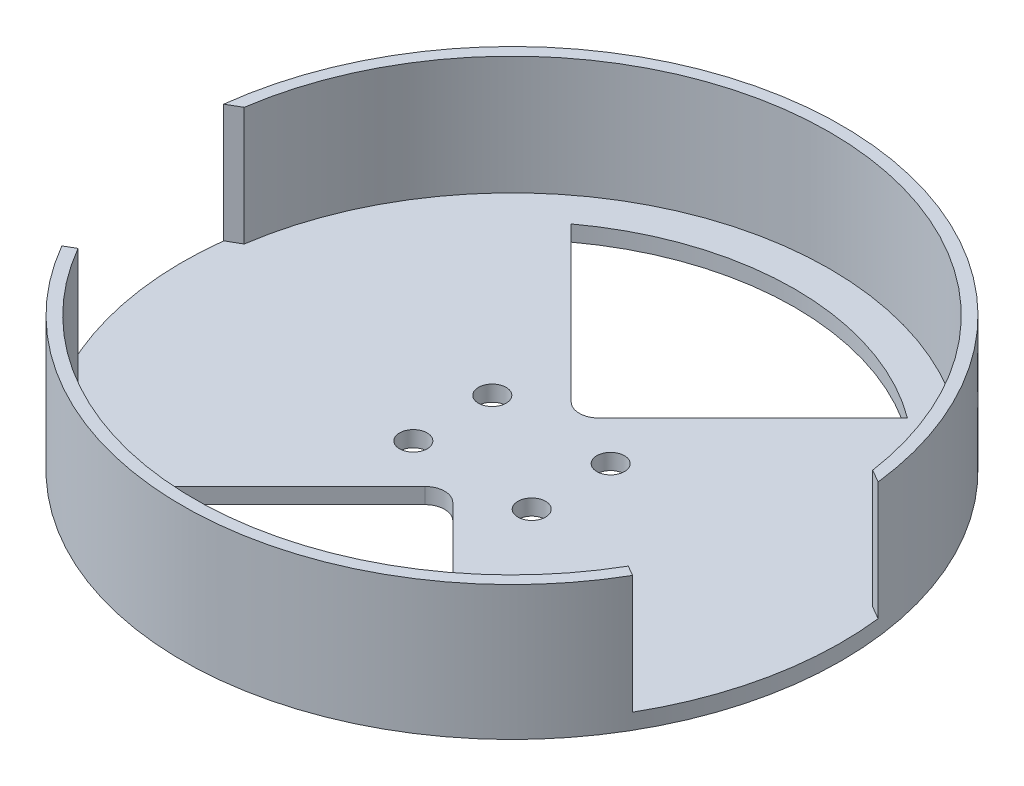
from build123d import *

# Parameters (mm, degrees)
CROQUIS1_R              = 80.5
SALIENTE_EXTRUIR1_DEPTH = 4
CROQUIS2_R              = 83.5
CROQUIS2_R_2            = 80.5
EXTRUIR_L_MINA1_DEPTH   = 34
CORTAR_EXTRUIR1_START   = -30
CORTAR_EXTRUIR1_DEPTH   = 30
CORTAR_EXTRUIR3_DEPTH   = 4
CROQUIS6_R              = 3.5
CORTAR_EXTRUIR4_DEPTH   = 10


with BuildPart() as part:
    # Croquis1 → Saliente-Extruir1 (new body)
    with BuildSketch(Plane(origin=(0, 0, 0), x_dir=(1, 0, 0), z_dir=(0, 1, 0))):
        with Locations(Location((0, 0, 0), (0, 0, 270))):
            Circle(CROQUIS1_R)
    extrude(amount=SALIENTE_EXTRUIR1_DEPTH)

    # Croquis2 → Extruir-Lámina1 (add)
    with BuildSketch(Plane(origin=(0, 0, 0), x_dir=(1, 0, 0), z_dir=(0, 1, 0))):
        Circle(CROQUIS2_R)
        Circle(CROQUIS2_R_2, mode=Mode.SUBTRACT)
    extrude(amount=EXTRUIR_L_MINA1_DEPTH)

    # Croquis3 → Cortar-Extruir1 (cut)
    with BuildSketch(Plane(origin=(0, 34, 0), x_dir=(1, 0, 0), z_dir=(0, 1, 0)).offset(CORTAR_EXTRUIR1_START)):
        with BuildLine():
            Line((82.915347707, 9.8638286), (79.63686942, 11.756658922))
            ThreePointArc((79.63686942, 11.756658922), (80.283927371, 5.894150138), (80.5, 0))
            ThreePointArc((80.5, 0), (77.757029016, -20.834933131), (69.715045005, -40.25))
            Line((69.715045005, -40.25), (72.313121216, -41.75))
            ThreePointArc((72.313121216, -41.75), (80.654806495, -21.611390266), (83.5, 0))
            ThreePointArc((83.5, 0), (83.353708776, 4.940570133), (82.915347707, 9.8638286))
        make_face()
        with BuildLine():
            ThreePointArc((-69.715045005, -40.25), (-79.073837194, -15.085697577), (-79.63686942, 11.756658922))
            Line((-79.63686942, 11.756658922), (-82.915347707, 9.8638286))
            ThreePointArc((-82.915347707, 9.8638286), (-81.792213668, -16.801303023), (-72.313121216, -41.75))
            Line((-72.313121216, -41.75), (-69.715045005, -40.25))
        make_face()
    extrude(amount=CORTAR_EXTRUIR1_DEPTH, mode=Mode.SUBTRACT)

    # Croquis4 → Cortar-Extruir3 (cut)
    with BuildSketch(Plane.XZ):
        with BuildLine():
            Line((-42.603387144, 57.603387144), (-3.535533906, 18.535533906))
            ThreePointArc((-3.535533906, 18.535533906), (0, 17.071067812), (3.535533906, 18.535533906))
            Line((3.535533906, 18.535533906), (42.603387144, 57.603387144))
            ThreePointArc((42.603387144, 57.603387144), (0, 71.646345383), (-42.603387144, 57.603387144))
        make_face()
        with BuildLine():
            Line((-3.535533906, -18.535533906), (-42.603387144, -57.603387144))
            ThreePointArc((-42.603387144, -57.603387144), (0, -71.646345383), (42.603387144, -57.603387144))
            Line((42.603387144, -57.603387144), (3.535533906, -18.535533906))
            ThreePointArc((3.535533906, -18.535533906), (0, -17.071067812), (-3.535533906, -18.535533906))
        make_face()
    extrude(amount=-CORTAR_EXTRUIR3_DEPTH, mode=Mode.SUBTRACT)

    # Croquis6 → Cortar-Extruir4 (cut)
    with BuildSketch(Plane.XZ):
        with Locations(Location((-15, 10, 0), (0, 0, 270))):
            Circle(CROQUIS6_R)
        with Locations(Location((-15, -10, 0), (0, 0, 270))):
            Circle(CROQUIS6_R)
        with Locations(Location((15, 10, 0), (0, 0, 270))):
            Circle(CROQUIS6_R)
        with Locations(Location((15, -10, 0), (0, 0, 270))):
            Circle(CROQUIS6_R)
    extrude(amount=-CORTAR_EXTRUIR4_DEPTH, mode=Mode.SUBTRACT)


solid = part.part
